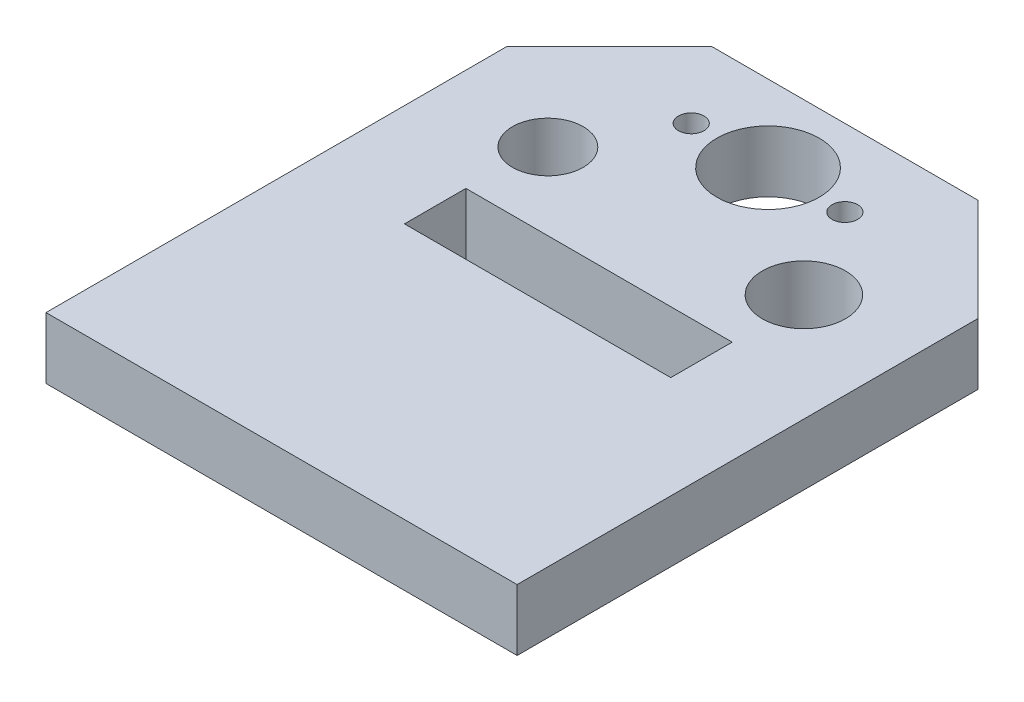
from build123d import *

# Parameters (mm, degrees)
SKETCH1_W           = 92
SKETCH1_H           = 110
BOSS_EXTRUDE1_DEPTH = 12
CUT_EXTRUDE1_REACH  = 74.698
SKETCH2_R           = 10
SKETCH2_R_2         = 6.902314271
SKETCH2_R_3         = 8.115527509
SKETCH2_R_4         = 2.5
CUT_EXTRUDE2_REACH  = 74.698
SKETCH3_W           = 52
SKETCH3_H           = 12
CHAMFER1_SIZE       = 20


with BuildPart() as part:
    # Sketch1 → Boss-Extrude1 (new body)
    with BuildSketch(Plane(origin=(0, 0, 0), x_dir=(1, 0, 0), z_dir=(0, 1, 0))):
        Rectangle(SKETCH1_W, SKETCH1_H)
    extrude(amount=BOSS_EXTRUDE1_DEPTH)

    # Sketch2 → Cut-Extrude1 (cut, up to next)
    with BuildSketch(Plane(origin=(0, 12, 0), x_dir=(1, 0, 0), z_dir=(0, 1, 0)), mode=Mode.PRIVATE) as cut_extrude1_sk1:
        with Locations(Location((0, 40, 0), (0, 0, 270))):
            Circle(SKETCH2_R)
    cut_extrude1_tool1 = extrude(cut_extrude1_sk1.sketch, amount=-CUT_EXTRUDE1_REACH, mode=Mode.PRIVATE) & part.part
    # Sketch2 → Cut-Extrude1 (cut, up to next)
    with BuildSketch(Plane(origin=(0, 12, 0), x_dir=(1, 0, 0), z_dir=(0, 1, 0)), mode=Mode.PRIVATE) as cut_extrude1_sk2:
        with Locations(Location((-25, 22, 0), (0, 0, 270))):
            Circle(SKETCH2_R_2)
    cut_extrude1_tool2 = extrude(cut_extrude1_sk2.sketch, amount=-CUT_EXTRUDE1_REACH, mode=Mode.PRIVATE) & part.part
    # Sketch2 → Cut-Extrude1 (cut, up to next)
    with BuildSketch(Plane(origin=(0, 12, 0), x_dir=(1, 0, 0), z_dir=(0, 1, 0)), mode=Mode.PRIVATE) as cut_extrude1_sk3:
        with Locations(Location((25, 22, 0), (0, 0, 270))):
            Circle(SKETCH2_R_3)
    cut_extrude1_tool3 = extrude(cut_extrude1_sk3.sketch, amount=-CUT_EXTRUDE1_REACH, mode=Mode.PRIVATE) & part.part
    # Sketch2 → Cut-Extrude1 (cut, up to next)
    with BuildSketch(Plane(origin=(0, 12, 0), x_dir=(1, 0, 0), z_dir=(0, 1, 0)), mode=Mode.PRIVATE) as cut_extrude1_sk4:
        with Locations(Location((-15, 40, 0), (0, 0, 270))):
            Circle(SKETCH2_R_4)
    cut_extrude1_tool4 = extrude(cut_extrude1_sk4.sketch, amount=-CUT_EXTRUDE1_REACH, mode=Mode.PRIVATE) & part.part
    # Sketch2 → Cut-Extrude1 (cut, up to next)
    with BuildSketch(Plane(origin=(0, 12, 0), x_dir=(1, 0, 0), z_dir=(0, 1, 0)), mode=Mode.PRIVATE) as cut_extrude1_sk5:
        with Locations(Location((15, 40, 0), (0, 0, 270))):
            Circle(SKETCH2_R_4)
    cut_extrude1_tool5 = extrude(cut_extrude1_sk5.sketch, amount=-CUT_EXTRUDE1_REACH, mode=Mode.PRIVATE) & part.part
    add(cut_extrude1_tool1.solids().sort_by_distance((0, 12, -40))[0], mode=Mode.SUBTRACT)
    add(cut_extrude1_tool2.solids().sort_by_distance((-25, 12, -22))[0], mode=Mode.SUBTRACT)
    add(cut_extrude1_tool3.solids().sort_by_distance((25, 12, -22))[0], mode=Mode.SUBTRACT)
    add(cut_extrude1_tool4.solids().sort_by_distance((-15, 12, -40))[0], mode=Mode.SUBTRACT)
    add(cut_extrude1_tool5.solids().sort_by_distance((15, 12, -40))[0], mode=Mode.SUBTRACT)

    # Sketch3 → Cut-Extrude2 (cut, up to next)
    with BuildSketch(Plane(origin=(0, 12, 0), x_dir=(1, 0, 0), z_dir=(0, 1, 0)), mode=Mode.PRIVATE) as cut_extrude2_sk1:
        with Locations((0, 1)):
            Rectangle(SKETCH3_W, SKETCH3_H)
    cut_extrude2_tool1 = extrude(cut_extrude2_sk1.sketch, amount=-CUT_EXTRUDE2_REACH, mode=Mode.PRIVATE) & part.part
    add(cut_extrude2_tool1.solids().sort_by_distance((0, 12, -1))[0], mode=Mode.SUBTRACT)

    # Chamfer1
    chamfer1_edges = [part.edges().sort_by_distance(p)[0] for p in [
        (-46, 6, -55),
        (46, 6, -55),
    ]]
    chamfer(chamfer1_edges, length=CHAMFER1_SIZE)


solid = part.part
